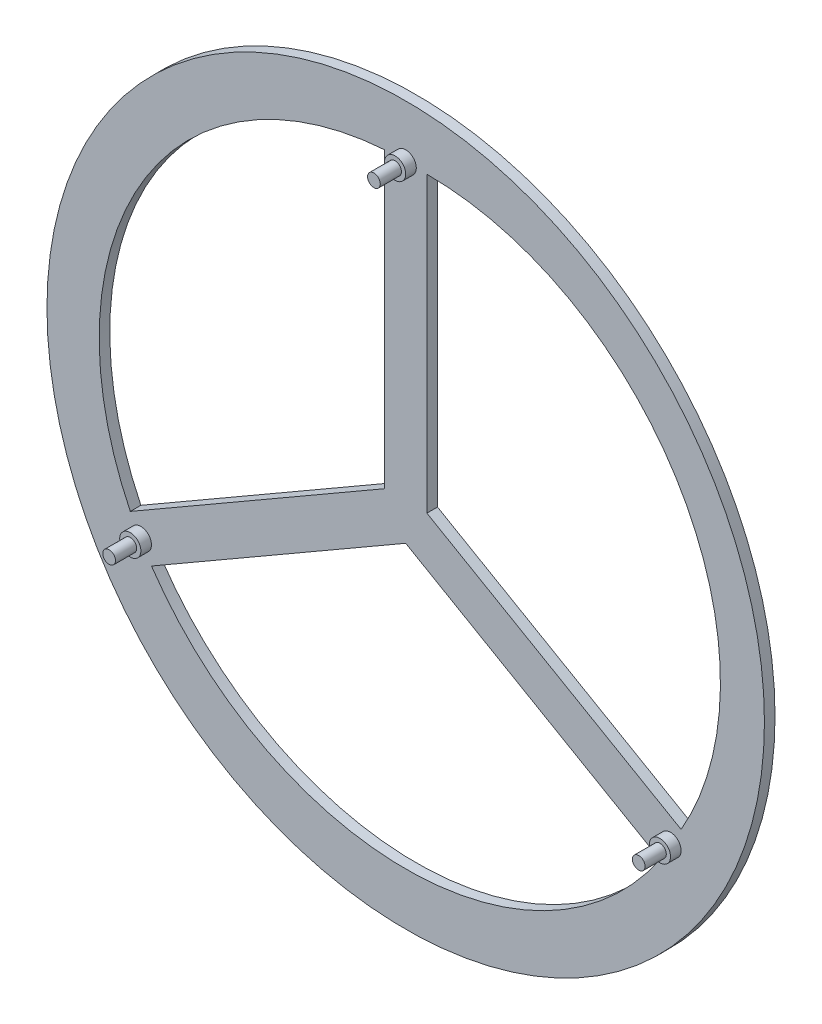
from build123d import *

# Parameters (mm, degrees)
SKETCH1_R           = 338.675134595
BOSS_EXTRUDE1_DEPTH = 10
SKETCH1_4_R         = 6
BOSS_EXTRUDE2_DEPTH = 40
SKETCH1_5_R         = 10
BOSS_EXTRUDE3_DEPTH = 20


with BuildPart() as part:
    # Sketch1 → Boss-Extrude1 (new body)
    with BuildSketch(Plane.XY):
        with Locations((-21.994465127, 277.22041187)):
            Circle(SKETCH1_R)
        with BuildLine():
            Line((-261.994465127, 115.562336497), (-21.994465127, 254.126401103))
            Line((-21.994465127, 254.126401103), (218.005534873, 115.562336497))
            ThreePointArc((218.005534873, 115.562336497), (-21.994465127, -12.146713653), (-261.994465127, 115.562336497))
        make_face(mode=Mode.SUBTRACT)
        with BuildLine():
            Line((-41.994465127, 565.895546465), (-41.994465127, 288.767417254))
            Line((-41.994465127, 288.767417254), (-281.994465127, 150.203352649))
            ThreePointArc((-281.994465127, 150.203352649), (-272.59374685, 421.903974632), (-41.994465127, 565.895546465))
        make_face(mode=Mode.SUBTRACT)
        with BuildLine():
            Line((238.005534873, 150.203352649), (-1.994465127, 288.767417254))
            Line((-1.994465127, 288.767417254), (-1.994465127, 565.895546465))
            ThreePointArc((-1.994465127, 565.895546465), (238.005534873, 427.33148186), (238.005534873, 150.203352649))
        make_face(mode=Mode.SUBTRACT)
    extrude(amount=BOSS_EXTRUDE1_DEPTH)

    # Sketch1<4> → Boss-Extrude2 (add)
    with BuildSketch(Plane.XY):
        with Locations((228.005534873, 132.882844573)):
            Circle(SKETCH1_4_R)
        with Locations((-271.994465127, 132.882844573)):
            Circle(SKETCH1_4_R)
        with Locations((-21.994465127, 565.895546465)):
            Circle(SKETCH1_4_R)
    extrude(amount=BOSS_EXTRUDE2_DEPTH)

    # Sketch1<5> → Boss-Extrude3 (add)
    with BuildSketch(Plane.XY):
        with Locations((-271.994465127, 132.882844573)):
            Circle(SKETCH1_5_R)
        with Locations((-21.994465127, 565.895546465)):
            Circle(SKETCH1_5_R)
        with Locations((228.005534873, 132.882844573)):
            Circle(SKETCH1_5_R)
    extrude(amount=BOSS_EXTRUDE3_DEPTH)


solid = part.part
